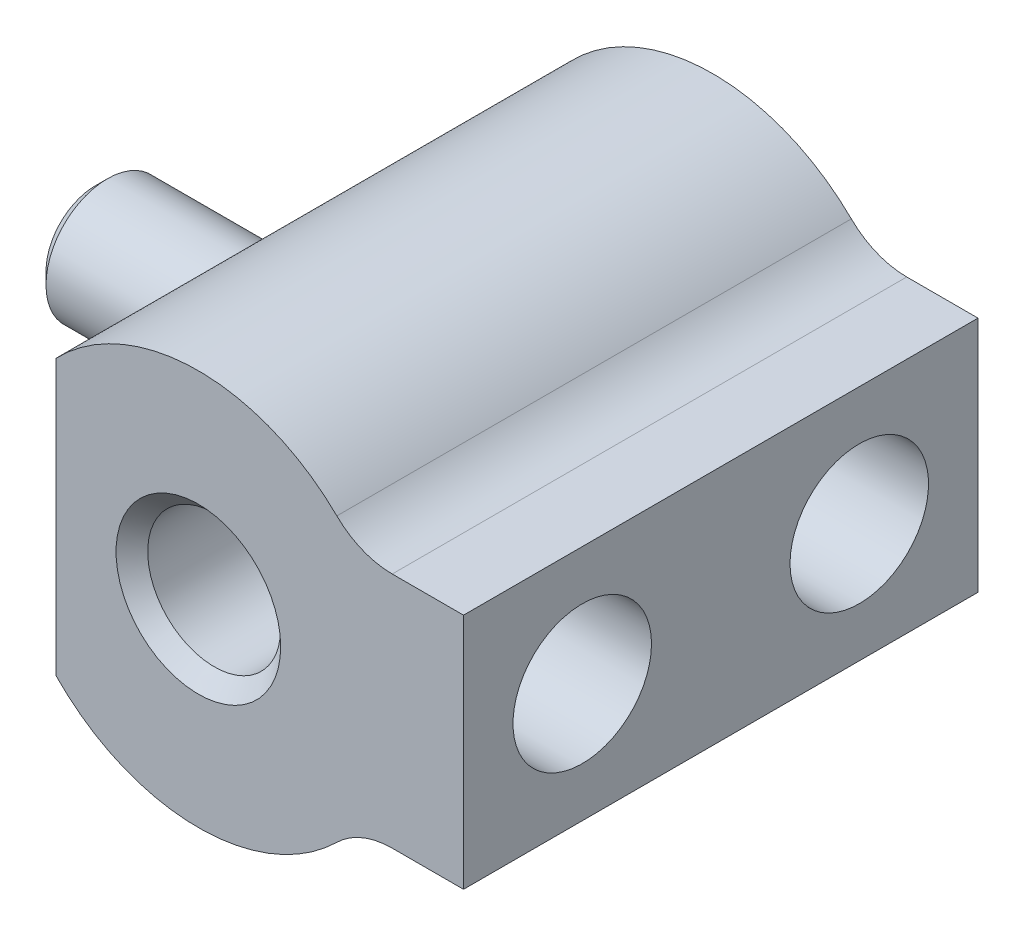
from build123d import *

# Parameters (mm, degrees)
SKETCH1_R           = 6.35
SKETCH1_R_2         = 2.1336
BOSS_EXTRUDE1_DEPTH = 8.255
CUT_EXTRUDE1_DEPTH  = 19.794283705
SKETCH4_R           = 1.9685
BOSS_EXTRUDE2_DEPTH = 6.985
SKETCH6_W           = 16.51
SKETCH6_H           = 7.62
BOSS_EXTRUDE3_DEPTH = 3.429
FILLET1_R           = 1.27
CHAMFER1_SIZE       = 0.381
SKETCH5_R           = 2.2225
CUT_EXTRUDE2_DEPTH  = 8.255
CHAMFER2_SIZE       = 0.508
FILLET2_R           = 2.54


with BuildPart() as part:
    # Sketch1 → Boss-Extrude1 (new, symmetric)
    with BuildSketch(Plane.XY):
        Circle(SKETCH1_R)
        Circle(SKETCH1_R_2, mode=Mode.SUBTRACT)
    extrude(amount=BOSS_EXTRUDE1_DEPTH, both=True)

    # Sketch3 → Cut-Extrude1 (cut, through all)
    with BuildSketch(Plane.XY.offset(8.255)):
        with BuildLine():
            Line((-4.572, 4.4067353), (-4.572, -4.4067353))
            ThreePointArc((-4.572, -4.4067353), (-6.35, 0), (-4.572, 4.4067353))
        make_face()
        with BuildLine():
            Line((5.08, 3.81), (5.08, -3.81))
            ThreePointArc((5.08, -3.81), (6.35, 0), (5.08, 3.81))
        make_face()
    extrude(amount=-CUT_EXTRUDE1_DEPTH, mode=Mode.SUBTRACT)

    # Sketch4 → Boss-Extrude2 (add)
    with BuildSketch(Plane.ZY.offset(4.572)):
        Circle(SKETCH4_R)
    extrude(amount=BOSS_EXTRUDE2_DEPTH)

    # Sketch6 → Boss-Extrude3 (add)
    with BuildSketch(Plane(origin=(5.08, 0, 0), x_dir=(0, 0, -1), z_dir=(1, 0, 0))):
        Rectangle(SKETCH6_W, SKETCH6_H)
    extrude(amount=BOSS_EXTRUDE3_DEPTH)

    # Fillet1
    fillet1_edges = [part.edges().sort_by_distance(p)[0] for p in [
        (-4.572, 0, -1.9685),
    ]]
    fillet(fillet1_edges, radius=FILLET1_R)

    # Chamfer1
    chamfer1_edges = [part.edges().sort_by_distance(p)[0] for p in [
        (-11.557, 0, -1.9685),
    ]]
    chamfer(chamfer1_edges, length=CHAMFER1_SIZE)

    # Sketch5 → Cut-Extrude2 (cut)
    with BuildSketch(Plane(origin=(8.509, 0, 0), x_dir=(0, 0, -1), z_dir=(1, 0, 0))):
        with Locations((-4.445, 0)):
            Circle(SKETCH5_R)
        with Locations(Location((4.445, 0, 0), (0, 0, 180.000000003))):
            Circle(SKETCH5_R)
    extrude(amount=-CUT_EXTRUDE2_DEPTH, mode=Mode.SUBTRACT)

    # Chamfer2
    chamfer2_edges = [part.edges().sort_by_distance(p)[0] for p in [
        (-2.1336, 0, -8.255),
        (-2.1336, 0, 8.255),
    ]]
    chamfer(chamfer2_edges, length=CHAMFER2_SIZE)

    # Fillet2
    fillet2_edges = [part.edges().sort_by_distance(p)[0] for p in [
        (5.08, 3.81, 0),
        (5.08, -3.81, 0),
    ]]
    fillet(fillet2_edges, radius=FILLET2_R)


solid = part.part
